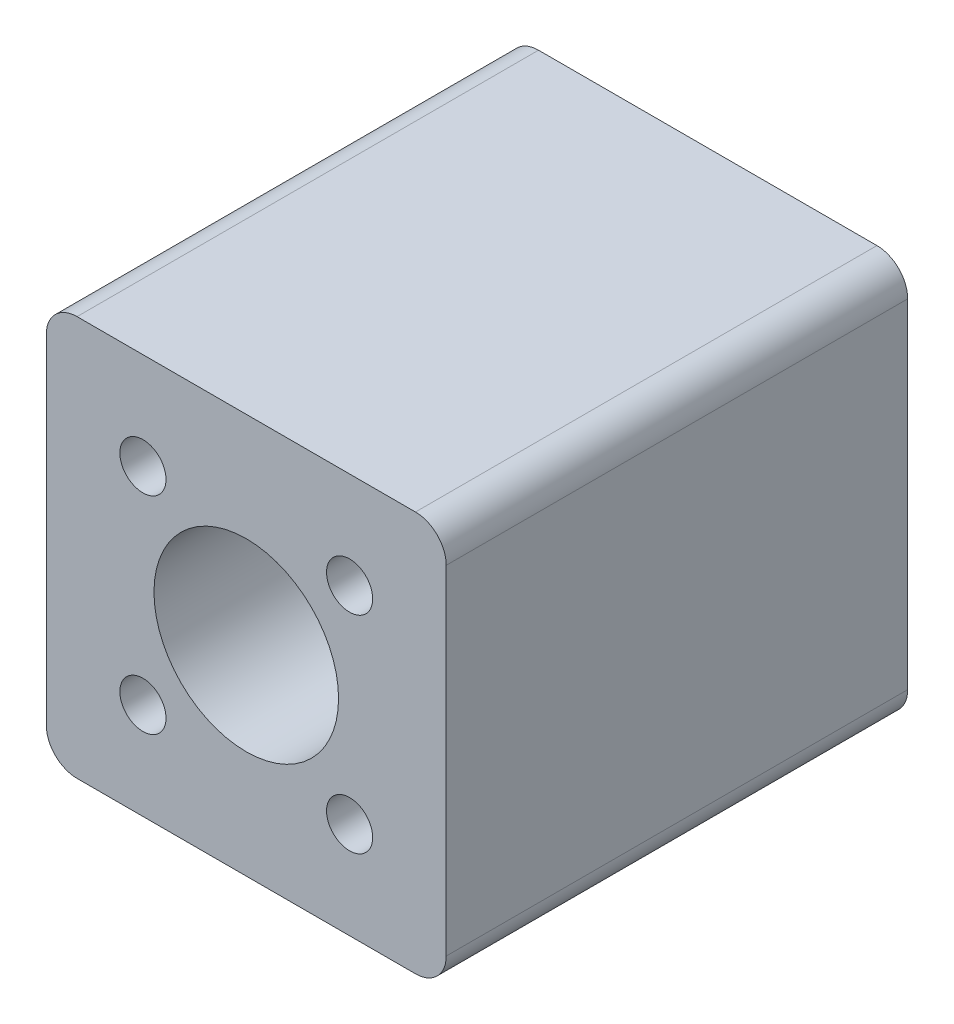
from build123d import *

# Parameters (mm, degrees)
SKETCH_1_R      = 1.5
SKETCH_1_R_2    = 6
EXTRUDE_1_DEPTH = 30


with BuildPart() as part:
    # 草图1 → 凸台-拉伸1 (new body)
    with BuildSketch(Plane.XY):
        with BuildLine():
            Line((0, 13), (11, 13))
            ThreePointArc((11, 13), (12.414213562, 12.414213562), (13, 11))
            Line((13, 11), (13, -11))
            ThreePointArc((13, -11), (12.414213562, -12.414213562), (11, -13))
            Line((11, -13), (-11, -13))
            ThreePointArc((-11, -13), (-12.414213562, -12.414213562), (-13, -11))
            Line((-13, -11), (-13, 11))
            ThreePointArc((-13, 11), (-12.414213562, 12.414213562), (-11, 13))
            Line((-11, 13), (0, 13))
        make_face()
        with Locations((-6.717514421, 6.717514421)):
            Circle(SKETCH_1_R, mode=Mode.SUBTRACT)
        with Locations((6.717514421, 6.717514421)):
            Circle(SKETCH_1_R, mode=Mode.SUBTRACT)
        with Locations((-6.717514421, -6.717514421)):
            Circle(SKETCH_1_R, mode=Mode.SUBTRACT)
        with Locations((6.717514421, -6.717514421)):
            Circle(SKETCH_1_R, mode=Mode.SUBTRACT)
        Circle(SKETCH_1_R_2, mode=Mode.SUBTRACT)
    extrude(amount=EXTRUDE_1_DEPTH)


solid = part.part
